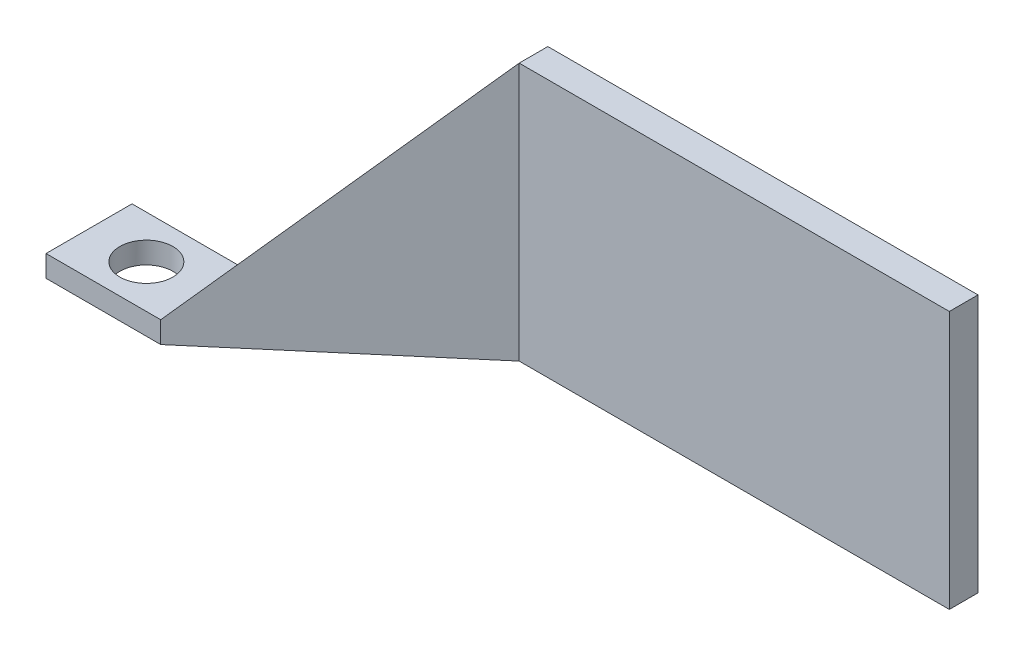
from build123d import *

# Parameters (mm, degrees)
SKETCH_1_W          = 8
SKETCH_1_H          = 1.5
EXTRUDE_1_DEPTH     = 6
SKETCH_2_W          = 30
SKETCH_2_H          = 2
EXTRUDE_2_DEPTH     = 18
SKETCH_3_R          = 1.85
CUT_EXTRUDE_1_DEPTH = 6


with BuildPart() as part:
    # 草图1 → 凸台-拉伸1 (new body)
    with BuildSketch(Plane.XY):
        with Locations((-4, -0.75)):
            Rectangle(SKETCH_1_W, SKETCH_1_H)
    extrude(amount=EXTRUDE_1_DEPTH)


with BuildPart() as body_2:
    # 草图2 → 凸台-拉伸2 (new body)
    with BuildSketch(Plane(origin=(0, 0, 0), x_dir=(1, 0, 0), z_dir=(0, 1, 0))):
        with Locations((30, 5)):
            Rectangle(SKETCH_2_W, SKETCH_2_H)
    extrude(amount=EXTRUDE_2_DEPTH)


    add(part.part)  # loft_1 joins it to this body
    # loft from a face of the part (loft_1)
    loft([body_2.faces().sort_by_distance((15, 9, -5))[0], body_2.faces().sort_by_distance((0, -0.75, 3))[0]])

    # 草图3 → 切除-拉伸1 (cut)
    with BuildSketch(Plane(origin=(0, 0, 0), x_dir=(1, 0, 0), z_dir=(0, 1, 0))):
        with Locations(Location((-4, -3, 0), (0, 0, 270))):
            Circle(SKETCH_3_R)
    extrude(amount=-CUT_EXTRUDE_1_DEPTH, mode=Mode.SUBTRACT)


solid = body_2.part
